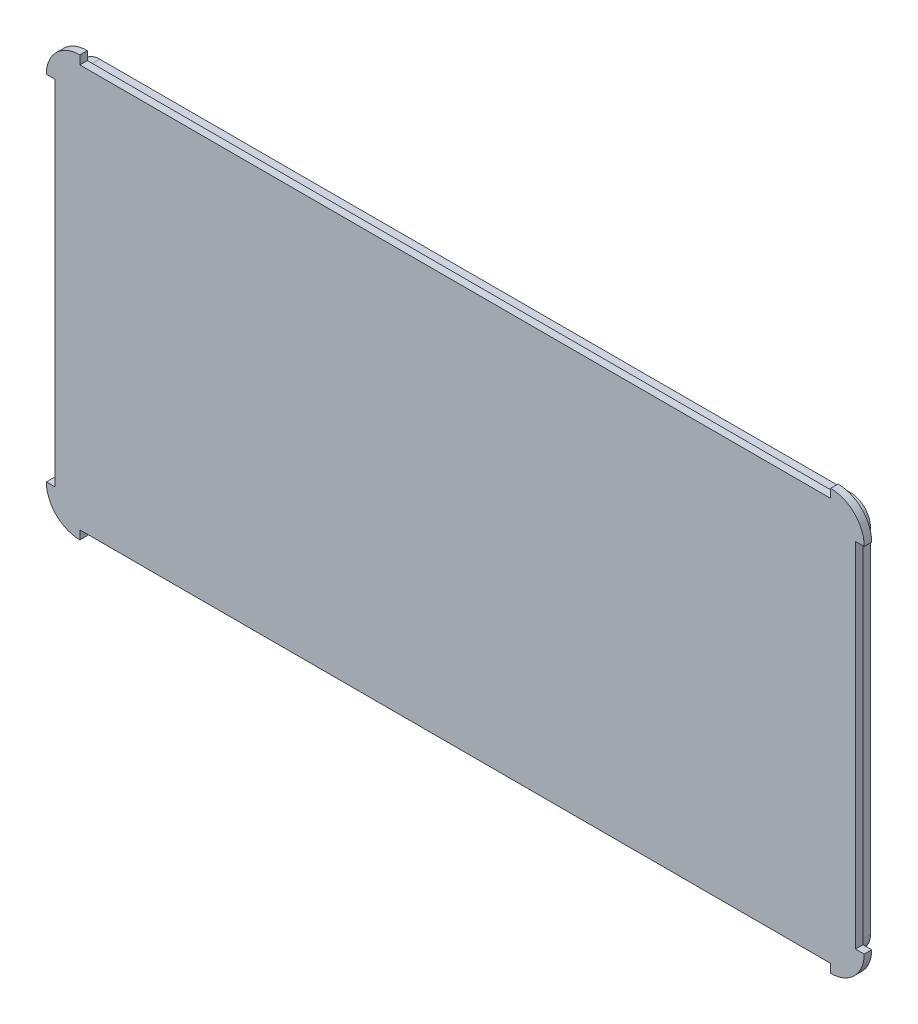
from build123d import *

# Parameters (mm, degrees)
BOSS_EXTRUDE2_DEPTH = 3
EXTRUDE_1_DEPTH     = 5
EXTRUDE_2_DEPTH     = 3


with BuildPart() as part:
    # Sketch3 → Boss-Extrude2 (new body)
    with BuildSketch(Plane.XY):
        with BuildLine():
            Line((-151, 81), (151, 81))
            ThreePointArc((151, 81), (158.071067812, 78.071067812), (161, 71))
            Line((161, 71), (161, -71))
            ThreePointArc((161, -71), (158.071067812, -78.071067812), (151, -81))
            Line((151, -81), (-151, -81))
            ThreePointArc((-151, -81), (-158.071067812, -78.071067812), (-161, -71))
            Line((-161, -71), (-161, 71))
            ThreePointArc((-161, 71), (-158.071067812, 78.071067812), (-151, 81))
        make_face()
    extrude(amount=-BOSS_EXTRUDE2_DEPTH)

    # Эскиз1 → Бобышка-Вытянуть1 (add)
    with BuildSketch(Plane(origin=(0, 0, -3), x_dir=(-1, 0, 0), z_dir=(0, 0, -1))):
        with BuildLine():
            Line((-151, -79), (151, -79))
            ThreePointArc((151, -79), (156.656854249, -76.656854249), (159, -71))
            Line((159, -71), (159, 71))
            ThreePointArc((159, 71), (156.656854249, 76.656854249), (151, 79))
            Line((151, 79), (-151, 79))
            ThreePointArc((-151, 79), (-156.656854249, 76.656854249), (-159, 71))
            Line((-159, 71), (-159, -71))
            ThreePointArc((-159, -71), (-156.656854249, -76.656854249), (-151, -79))
        make_face()
    extrude(amount=EXTRUDE_1_DEPTH)

    # Эскиз2 → Бобышка-Вытянуть2 (add)
    with BuildSketch(Plane.XY):
        with BuildLine():
            Line((-164.5, 71), (-151, 71))
            Line((-151, 71), (-151, 84.5))
            ThreePointArc((-151, 84.5), (-160.545941546, 80.545941546), (-164.5, 71))
        make_face()
        with BuildLine():
            Line((164.5, -71), (151, -71))
            Line((151, -71), (151, -84.5))
            ThreePointArc((151, -84.5), (160.545941546, -80.545941546), (164.5, -71))
        make_face()
        with BuildLine():
            Line((-151, -84.5), (-151, -71))
            Line((-151, -71), (-164.5, -71))
            ThreePointArc((-164.5, -71), (-160.545941546, -80.545941546), (-151, -84.5))
        make_face()
        with BuildLine():
            Line((151, 84.5), (151, 71))
            Line((151, 71), (164.5, 71))
            ThreePointArc((164.5, 71), (160.545941546, 80.545941546), (151, 84.5))
        make_face()
    extrude(amount=-EXTRUDE_2_DEPTH)


solid = part.part
